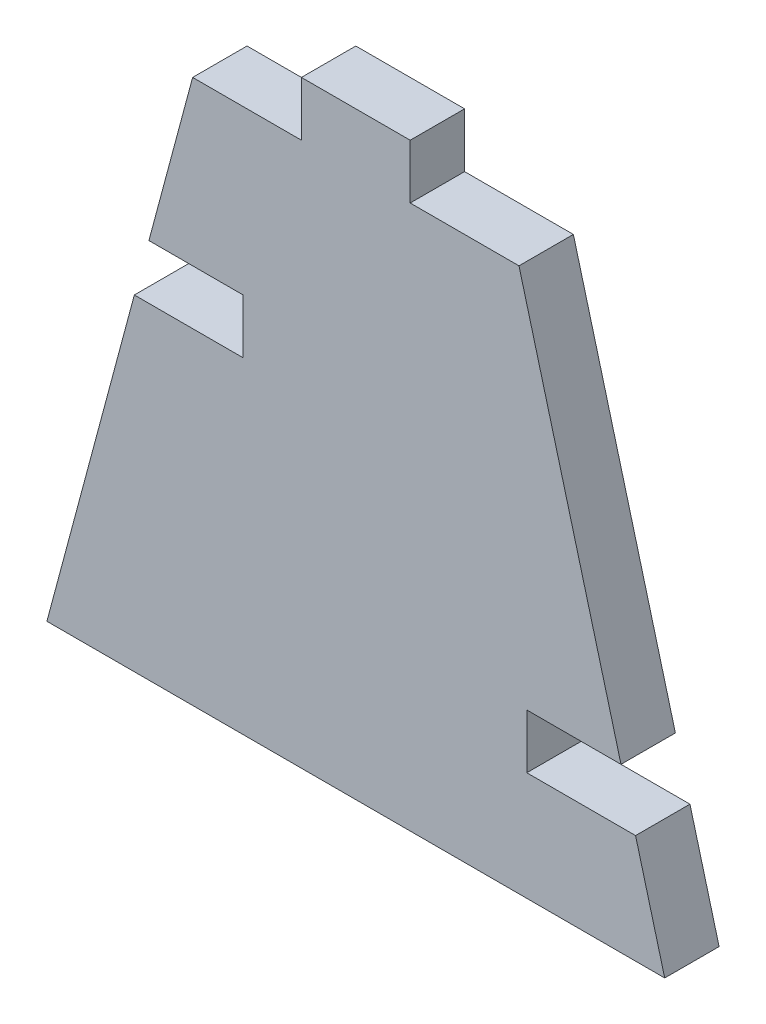
from build123d import *

# Parameters (mm, degrees)
BOSS_EXTRUDE1_DEPTH = 10


with BuildPart() as part:
    # Sketch2 → Boss-Extrude1 (new body)
    with BuildSketch(Plane.XY):
        Polygon((0, 0), (20, 0), (20, 10), (40, 10), (40, 0), (60, 0), (78.75644347, -70), (61.435935394, -70), (61.435935394, -80), (81.435935394, -80), (86.794919243, -100), (-26.794919243, -100), (-10.717967697, -40), (9.282032303, -40), (9.282032303, -30), (-8.038475773, -30), align=None)
    extrude(amount=BOSS_EXTRUDE1_DEPTH)


solid = part.part
